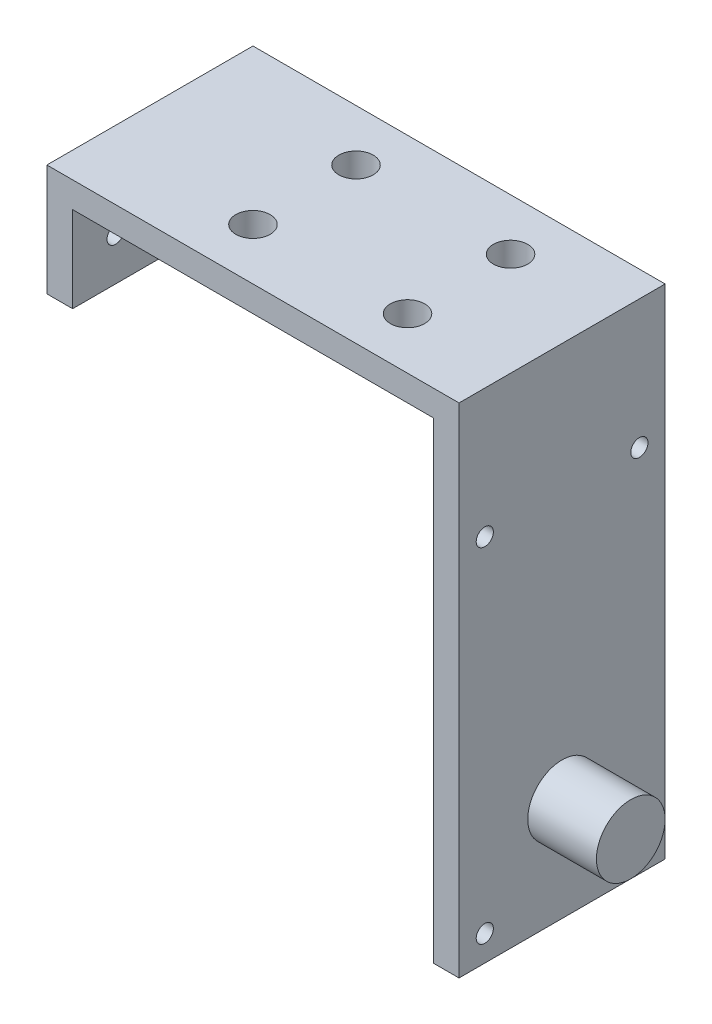
from build123d import *

# Parameters (mm, degrees)
SKETCH1_W           = 24
SKETCH1_H           = 29
SKETCH1_W_2         = 21
SKETCH1_H_2         = 26
BOSS_EXTRUDE1_DEPTH = 12
SKETCH2_W           = 21
SKETCH2_H           = 12
CUT_EXTRUDE1_DEPTH  = 33.314857264
SKETCH4_W           = 12
SKETCH4_H           = 22.5
CUT_EXTRUDE2_DEPTH  = 12
SKETCH5_R           = 0.5
CUT_EXTRUDE3_DEPTH  = 12
SKETCH6_R           = 0.5
CUT_EXTRUDE4_DEPTH  = 12
SKETCH7_R           = 2
BOSS_EXTRUDE2_DEPTH = 4
SKETCH9_R           = 1
CUT_EXTRUDE5_DEPTH  = 10


with BuildPart() as part:
    # Sketch1 → Boss-Extrude1 (new body)
    with BuildSketch(Plane.XY):
        Rectangle(SKETCH1_W, SKETCH1_H)
        Rectangle(SKETCH1_W_2, SKETCH1_H_2, mode=Mode.SUBTRACT)
    extrude(amount=BOSS_EXTRUDE1_DEPTH)

    # Sketch2 → Cut-Extrude1 (cut, through all)
    with BuildSketch(Plane(origin=(0, -13, 0), x_dir=(1, 0, 0), z_dir=(0, 1, 0))):
        with Locations((0, -6)):
            Rectangle(SKETCH2_W, SKETCH2_H)
    extrude(amount=-CUT_EXTRUDE1_DEPTH, mode=Mode.SUBTRACT)

    # Sketch4 → Cut-Extrude2 (cut)
    with BuildSketch(Plane.ZY.offset(12)):
        with Locations((6, -3.25)):
            Rectangle(SKETCH4_W, SKETCH4_H)
    extrude(amount=-CUT_EXTRUDE2_DEPTH, mode=Mode.SUBTRACT)

    # Sketch5 → Cut-Extrude3 (cut)
    with BuildSketch(Plane(origin=(12, 0, 0), x_dir=(0, 0, -1), z_dir=(1, 0, 0))):
        with Locations(Location((-10.5, -13, 0), (0, 0, 90))):
            Circle(SKETCH5_R)
        with Locations(Location((-1.5, -13, 0), (0, 0, 270))):
            Circle(SKETCH5_R)
        with Locations(Location((-10.5, 7, 0), (0, 0, 90))):
            Circle(SKETCH5_R)
        with Locations(Location((-1.5, 7, 0), (0, 0, 270))):
            Circle(SKETCH5_R)
    extrude(amount=-CUT_EXTRUDE3_DEPTH, mode=Mode.SUBTRACT)

    # Sketch6 → Cut-Extrude4 (cut)
    with BuildSketch(Plane.ZY.offset(12)):
        with Locations(Location((9.5, 10.5, 0), (0, 0, 270))):
            Circle(SKETCH6_R)
        with Locations(Location((2.5, 10.5, 0), (0, 0, 90))):
            Circle(SKETCH6_R)
    extrude(amount=-CUT_EXTRUDE4_DEPTH, mode=Mode.SUBTRACT)

    # Sketch7 → Boss-Extrude2 (add)
    with BuildSketch(Plane(origin=(12, 0, 0), x_dir=(0, 0, -1), z_dir=(1, 0, 0))):
        with Locations(Location((-6, -8.5, 0), (0, 0, 270))):
            Circle(SKETCH7_R)
    extrude(amount=BOSS_EXTRUDE2_DEPTH)

    # Sketch9 → Cut-Extrude5 (cut)
    with BuildSketch(Plane(origin=(0, 14.5, 0), x_dir=(1, 0, 0), z_dir=(0, 1, 0))):
        with Locations(Location((6, -3, 0), (0, 0, 270))):
            Circle(SKETCH9_R)
        with Locations(Location((6, -9, 0), (0, 0, 90))):
            Circle(SKETCH9_R)
        with Locations(Location((-3, -3, 0), (0, 0, 270))):
            Circle(SKETCH9_R)
        with Locations(Location((-3, -9, 0), (0, 0, 90))):
            Circle(SKETCH9_R)
    extrude(amount=-CUT_EXTRUDE5_DEPTH, mode=Mode.SUBTRACT)


solid = part.part
